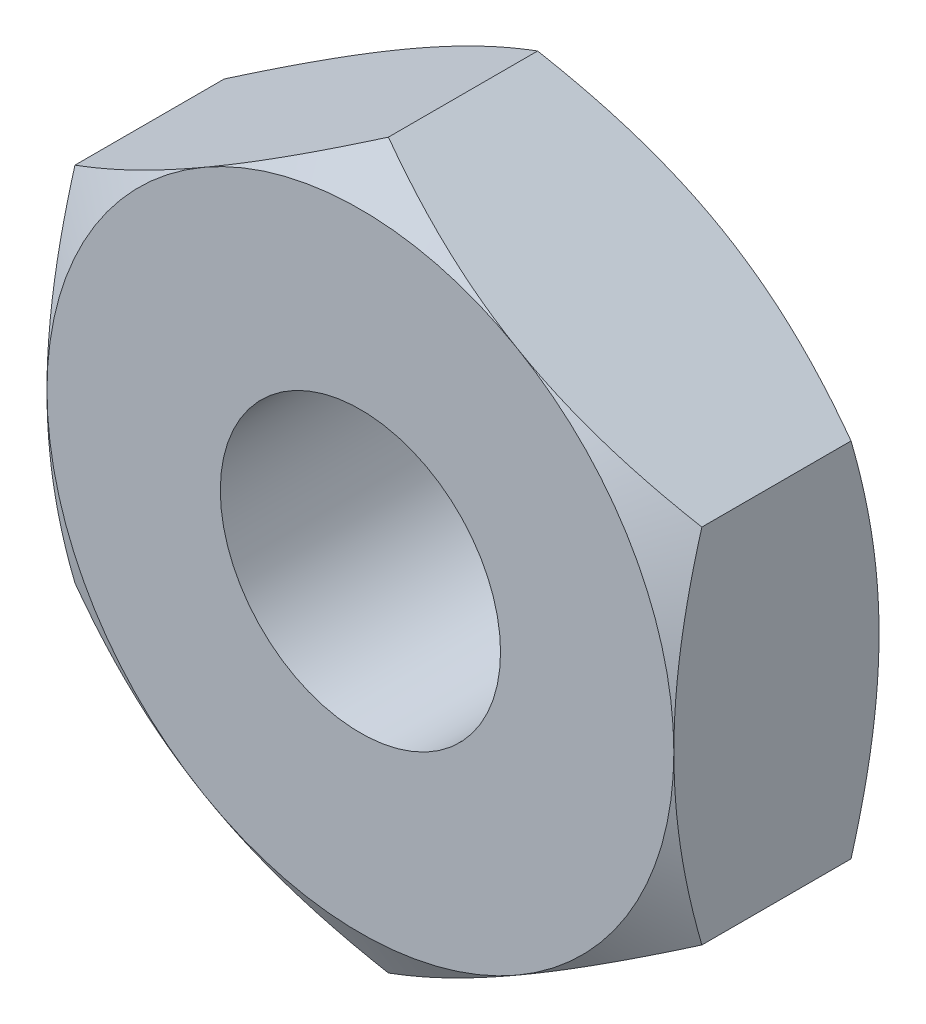
from build123d import *

# Parameters (mm, degrees)
SKETCH_1_R          = 1.229375
EXTRUDE_584_DEPTH   = 1.8
SKETCH_2_OUTSIDE_W  = 28.514
SKETCH_2_OUTSIDE_H  = 29.364
SKETCH_2_OUTSIDE_R  = 2.75
CUT_EXTRUDE_1_DEPTH = 5.570102114
CUT_EXTRUDE_1_DRAFT = -60
SKETCH_3_OUTSIDE_W  = 28.514
SKETCH_3_OUTSIDE_H  = 29.364
SKETCH_3_OUTSIDE_R  = 2.75
CUT_EXTRUDE_2_DEPTH = 5.570102114
CUT_EXTRUDE_2_DRAFT = -60


with BuildPart() as part:
    # 草图1 → Extrude 584 (new body)
    with BuildSketch(Plane.XY):
        Polygon((0, 3.175426481), (-2.75, 1.58771324), (-2.75, -1.58771324), (0, -3.175426481), (2.75, -1.58771324), (2.75, 1.58771324), align=None)
        Circle(SKETCH_1_R, mode=Mode.SUBTRACT)
    extrude(amount=EXTRUDE_584_DEPTH)


with BuildPart() as cut_extrude_1_tool:
    # 草图2 outside → 切除-拉伸1 (with draft: the straight prism first)
    with BuildSketch(Plane(origin=(0, 0, 0), x_dir=(-1, 0, 0), z_dir=(0, 0, -1))):
        Rectangle(SKETCH_2_OUTSIDE_W, SKETCH_2_OUTSIDE_H)
        Circle(SKETCH_2_OUTSIDE_R, mode=Mode.SUBTRACT)
    extrude(amount=-CUT_EXTRUDE_1_DEPTH)
    # 切除-拉伸1: the draft: its side faces are tilted about the plane it starts from
    cut_extrude_1_sides = [cut_extrude_1_tool.faces().sort_by_distance(p)[0] for p in [
        (0, -14.682, 2.785051057),
        (-14.257, 0, 2.785051057),
        (0, 14.682, 2.785051057),
        (14.257, 0, 2.785051057),
        (2.75, 0, 2.785051057),
    ]]
    draft(cut_extrude_1_sides, Plane(origin=(0, 0, 0), x_dir=(-1, 0, 0), z_dir=(0, 0, -1)), CUT_EXTRUDE_1_DRAFT)


with BuildPart() as part_1:
    add(part.part)

    # 切除-拉伸1: cut by cut_extrude_1_tool
    add(cut_extrude_1_tool.part, mode=Mode.SUBTRACT)


with BuildPart() as cut_extrude_2_tool:
    # 草图3 outside → 切除-拉伸2 (with draft: the straight prism first)
    with BuildSketch(Plane.XY.offset(1.8)):
        Rectangle(SKETCH_3_OUTSIDE_W, SKETCH_3_OUTSIDE_H)
        Circle(SKETCH_3_OUTSIDE_R, mode=Mode.SUBTRACT)
    extrude(amount=-CUT_EXTRUDE_2_DEPTH)
    # 切除-拉伸2: the draft: its side faces are tilted about the plane it starts from
    cut_extrude_2_sides = [cut_extrude_2_tool.faces().sort_by_distance(p)[0] for p in [
        (0, -14.682, -0.985051057),
        (14.257, 0, -0.985051057),
        (0, 14.682, -0.985051057),
        (-14.257, 0, -0.985051057),
        (-2.75, 0, -0.985051057),
    ]]
    draft(cut_extrude_2_sides, Plane.XY.offset(1.8), CUT_EXTRUDE_2_DRAFT)


with BuildPart() as part_2:
    add(part_1.part)

    # 切除-拉伸2: cut by cut_extrude_2_tool
    add(cut_extrude_2_tool.part, mode=Mode.SUBTRACT)


solid = part_2.part
